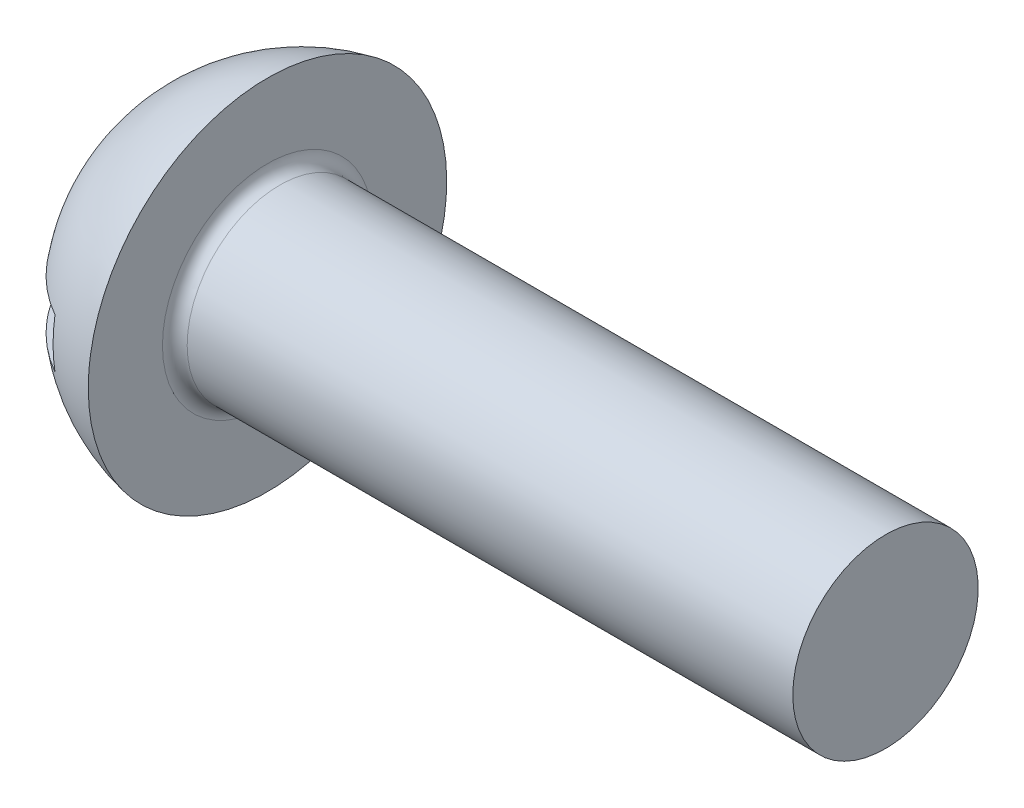
from build123d import *

# Parameters (mm, degrees)
SKETCH_2_W          = 5.8
SKETCH_2_H          = 0.8
CUT_EXTRUDE_1_DEPTH = 1.5
FILLET_1_R          = 0.2


with BuildPart() as part:
    # 草图1 → 旋转1 (revolve)
    with BuildSketch(Plane.XY):
        with BuildLine():
            Line((2.4, 2.9), (2.4, 1.5))
            Line((2.4, 1.5), (6.4, 1.5))
            Line((6.4, 1.5), (12.4, 1.5))
            Line((12.4, 1.5), (12.4, 0))
            Line((12.4, 0), (0, 0))
            ThreePointArc((0, 0), (0.677815098, 1.882153022), (2.4, 2.9))
        make_face()
    revolve(axis=Axis((0, 0, 0), (1, 0, 0)))

    # 草图2 → 切除-拉伸1 (cut)
    with BuildSketch(Plane(origin=(0, 0, 0), x_dir=(0, 0, -1), z_dir=(1, 0, 0))):
        Rectangle(SKETCH_2_W, SKETCH_2_H)
    extrude(amount=CUT_EXTRUDE_1_DEPTH, mode=Mode.SUBTRACT)

    # 圆角1
    fillet_1_edges = [part.edges().sort_by_distance(p)[0] for p in [
        (2.4, -1.5, 0),
    ]]
    fillet(fillet_1_edges, radius=FILLET_1_R)


solid = part.part
